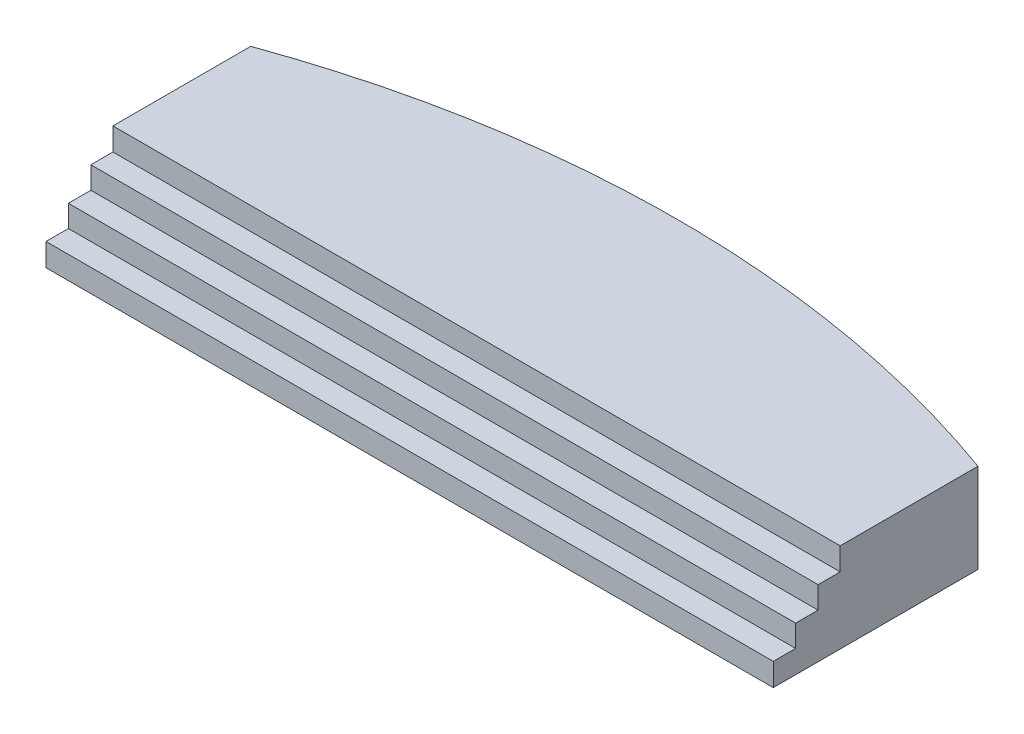
from build123d import *

# Parameters (mm, degrees)
BOSS_EXTRUDE1_DEPTH = 1000
CUT_EXTRUDE1_DEPTH  = 24000
BOSS_EXTRUDE2_DEPTH = 202.99281
CUT_EXTRUDE5_START  = -4000
CUT_EXTRUDE5_DEPTH  = 4000


with BuildPart() as part:
    # Sketch1 → Boss-Extrude1 (new body)
    with BuildSketch(Plane(origin=(0, 0, 0), x_dir=(1, 0, 0), z_dir=(0, 1, 0))):
        with BuildLine():
            Line((-4067.116172071, 9000), (3864.123361974, 9000))
            Line((3864.123361974, 9000), (3864.123361974, 11360.834064603))
            ThreePointArc((3864.123361974, 11360.834064603), (1958.314482503, 11839.130220908), (0, 12000))
            ThreePointArc((0, 12000), (-2064.332945394, 11821.105256725), (-4067.116172071, 11289.754915094))
            Line((-4067.116172071, 11289.754915094), (-4067.116172071, 9000))
        make_face()
    extrude(amount=BOSS_EXTRUDE1_DEPTH)

    # Sketch2 → Cut-Extrude1 (cut)
    with BuildSketch(Plane(origin=(3864.123361974, 0, 0), x_dir=(0, 0, -1), z_dir=(1, 0, 0))):
        Polygon((9000, 254.910429711), (9250.24574489, 254.910429711), (9250.24574489, 500), (9501.411916095, 500), (9501.411916095, 747.115103928), (9748.527020023, 747.115103928), (9748.527020023, 1000), (9000, 1000), align=None)
    extrude(amount=-CUT_EXTRUDE1_DEPTH, mode=Mode.SUBTRACT)

    # Sketch4 → Boss-Extrude2 (add)
    with BuildSketch(Plane(origin=(3864.123361974, 0, 0), x_dir=(0, 0, -1), z_dir=(1, 0, 0))):
        Polygon((9000, 254.910429711), (9000, 0), (11360.834064603, 0), (11360.834064603, 1000), (9748.527020023, 1000), (9748.527020023, 747.115103928), (9501.411916095, 747.115103928), (9501.411916095, 500), (9250.24574489, 500), (9250.24574489, 254.910429711), align=None)
    extrude(amount=BOSS_EXTRUDE2_DEPTH)

    # Sketch5 → Cut-Extrude5 (cut)
    with BuildSketch(Plane(origin=(0, 1000, 0), x_dir=(1, 0, 0), z_dir=(0, 1, 0)).offset(CUT_EXTRUDE5_START)):
        with BuildLine():
            Line((4067.116172071, 11289.754915094), (4067.116171974, 11360.834064603))
            Line((4067.116171974, 11360.834064603), (3864.123361974, 11360.834064603))
            ThreePointArc((3864.123361974, 11360.834064603), (3965.779015272, 11325.749282146), (4067.116172071, 11289.754915094))
        make_face()
    extrude(amount=CUT_EXTRUDE5_DEPTH, mode=Mode.SUBTRACT)


solid = part.part
